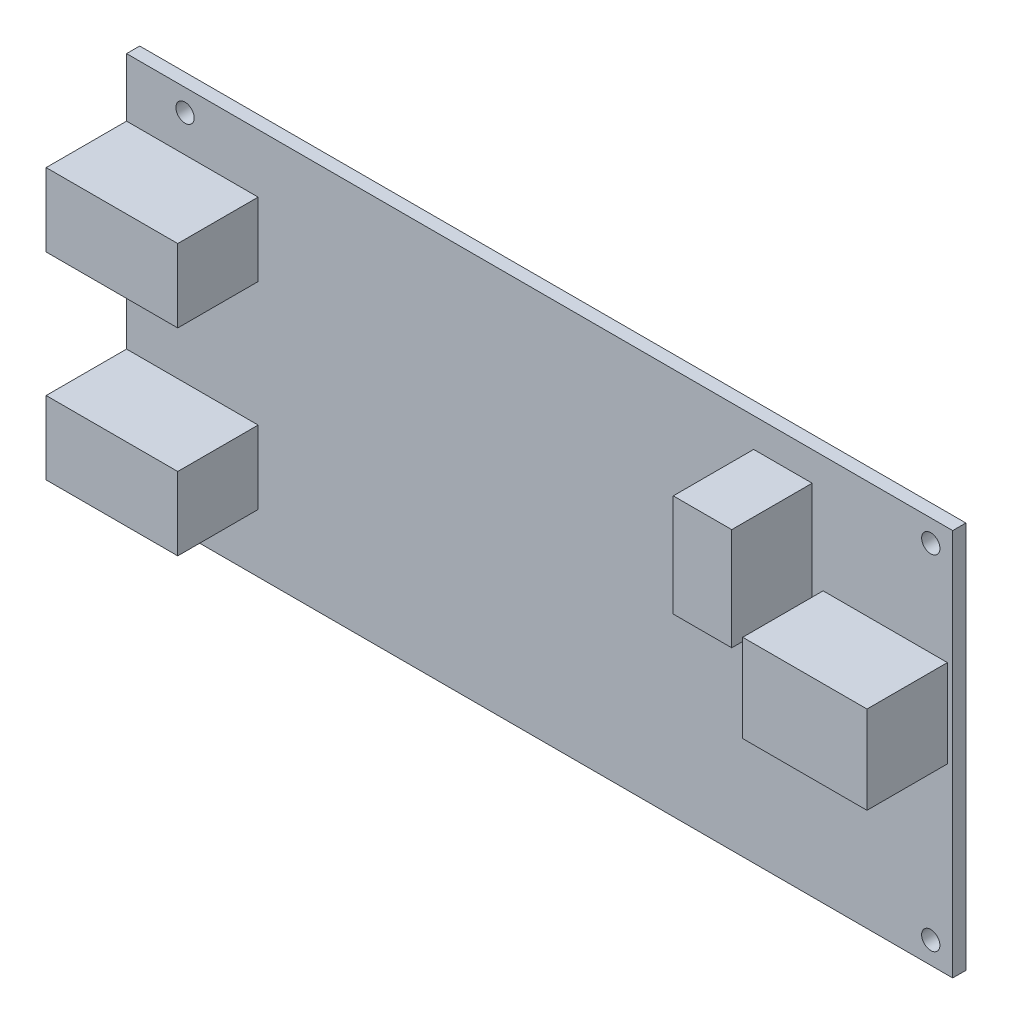
from build123d import *

# Parameters (mm, degrees)
SKETCH1_W           = 113
SKETCH1_H           = 53
SKETCH1_R           = 1.25
BOSS_EXTRUDE1_DEPTH = 1.8
SKETCH2_W           = 17
SKETCH2_H           = 12
SKETCH2_W_2         = 8
SKETCH2_H_2         = 14
SKETCH2_W_3         = 18
SKETCH2_H_3         = 10
BOSS_EXTRUDE2_DEPTH = 11


with BuildPart() as part:
    # Sketch1 → Boss-Extrude1 (new body)
    with BuildSketch(Plane.XY):
        with Locations((-56.5, 26.5)):
            Rectangle(SKETCH1_W, SKETCH1_H)
        with Locations((-3, 3)):
            Circle(SKETCH1_R, mode=Mode.SUBTRACT)
        with Locations((-3, 50)):
            Circle(SKETCH1_R, mode=Mode.SUBTRACT)
        with Locations((-105, 50)):
            Circle(SKETCH1_R, mode=Mode.SUBTRACT)
        with Locations((-105, 3)):
            Circle(SKETCH1_R, mode=Mode.SUBTRACT)
    extrude(amount=BOSS_EXTRUDE1_DEPTH)

    # Sketch2 → Boss-Extrude2 (add)
    with BuildSketch(Plane.XY.offset(1.8)):
        with Locations((-9.223845793, 31)):
            Rectangle(SKETCH2_W, SKETCH2_H)
        with Locations((-23.223845793, 42)):
            Rectangle(SKETCH2_W_2, SKETCH2_H_2)
        with Locations((-104, 40)):
            Rectangle(SKETCH2_W_3, SKETCH2_H_3)
        with Locations((-104, 13)):
            Rectangle(SKETCH2_W_3, SKETCH2_H_3)
    extrude(amount=BOSS_EXTRUDE2_DEPTH)


solid = part.part
